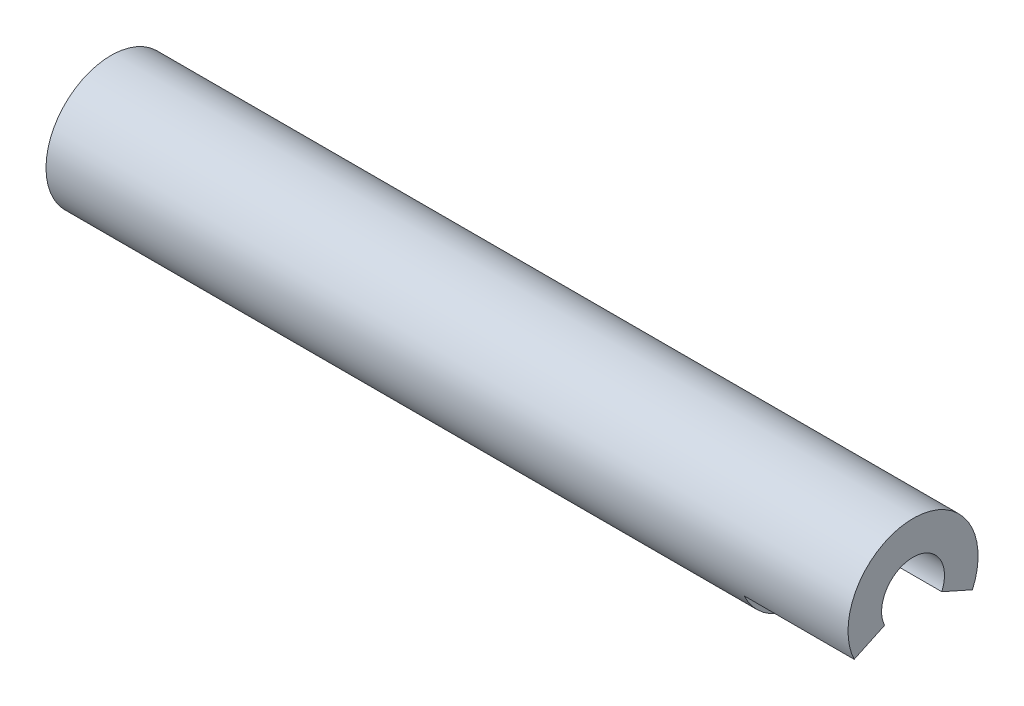
from build123d import *

# Parameters (mm, degrees)
IZIM1_W               = 153
IZIM1_H               = 12.405405405
KES_EKSTR_ZYON1_DEPTH = 21
KES_EKSTR_ZYON2_START = -21
KES_EKSTR_ZYON2_DEPTH = 21


with BuildPart() as part:
    # Çizim1 → Döndür1 (revolve)
    with BuildSketch(Plane(origin=(0, 0, 0), x_dir=(-1, 0, 0), z_dir=(0, 0, -1)), mode=Mode.PRIVATE) as d_nd_r1_sk:
        with Locations((-76.5, 6.202702703)):
            Rectangle(IZIM1_W, IZIM1_H)
    revolve(d_nd_r1_sk.sketch.rotate(Axis((153, 0, 0), (-1, 0, 0)), 270), axis=Axis((153, 0, 0), (-1, 0, 0)))

    # Çizim2 → Kes-Ekstrüzyon1 (cut)
    with BuildSketch(Plane(origin=(153, 0, 0), x_dir=(0, 0, -1), z_dir=(1, 0, 0))):
        with BuildLine():
            Line((5.478492651, -2.446654506), (11.327153725, -5.058623505))
            ThreePointArc((11.327153725, -5.058623505), (0.113988201, -12.404881699), (-11.232281693, -5.26592169))
            Line((-11.232281693, -5.26592169), (-5.432606832, -2.546916373))
            ThreePointArc((-5.432606832, -2.546916373), (-0.055131548, 5.999746704), (5.478492651, -2.446654506))
        make_face()
    extrude(amount=-KES_EKSTR_ZYON1_DEPTH, mode=Mode.SUBTRACT)

    # Çizim3 → Kes-Ekstrüzyon2 (cut)
    with BuildSketch(Plane.ZY.offset(KES_EKSTR_ZYON2_START)):
        with BuildLine():
            ThreePointArc((2.25, -5.562148865), (0, 6), (-2.25, -5.562148865))
            ThreePointArc((-2.25, -5.562148865), (0, -6), (2.25, -5.562148865))
        make_face()
    extrude(amount=KES_EKSTR_ZYON2_DEPTH, mode=Mode.SUBTRACT)


solid = part.part
